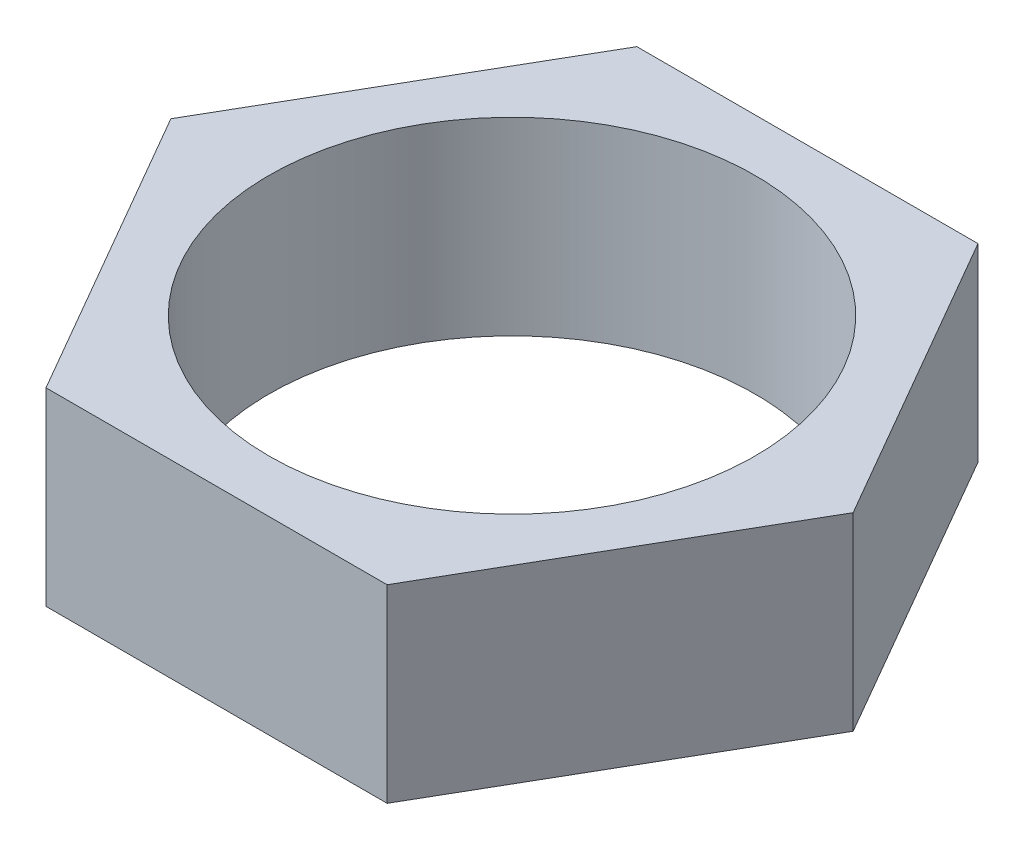
from build123d import *

# Parameters (mm, degrees)
BOSS_EXTRUDE1_DEPTH      = 1.9939
BOSS_EXTRUDE1_DEPTH_BACK = 1.9939
SKETCH1_R                = 5.12


with BuildPart() as part:
    # Sketch1 → Boss-Extrude1 (new, two sides: drawn at the far end of the back side and taken through both)
    with BuildSketch(Plane(origin=(0, 0, 0), x_dir=(1, 0, 0), z_dir=(0, 1, 0)).offset(-BOSS_EXTRUDE1_DEPTH_BACK)):
        Polygon((-3.592850725, 6.223), (-7.18570145, 0), (-3.592850725, -6.223), (3.592850725, -6.223), (7.18570145, 0), (3.592850725, 6.223), align=None)
        Circle(SKETCH1_R, mode=Mode.SUBTRACT)
    extrude(amount=BOSS_EXTRUDE1_DEPTH + BOSS_EXTRUDE1_DEPTH_BACK)


solid = part.part
